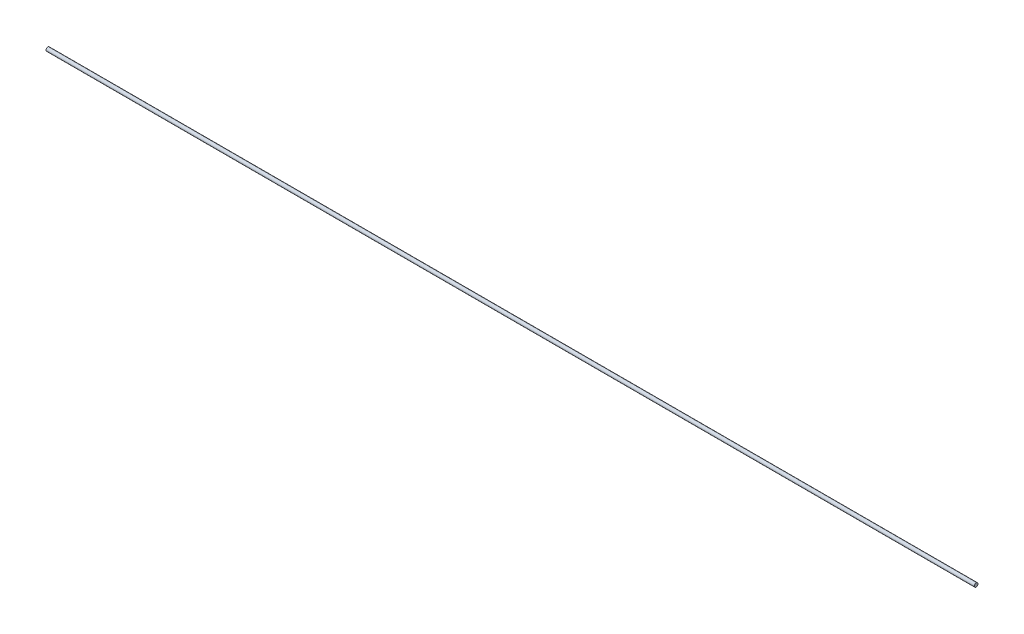
from build123d import *

# Parameters (mm, degrees)
SKETCH1_R           = 3.175
BOSS_EXTRUDE1_DEPTH = 1593.85


with BuildPart() as part:
    # Sketch1 → Boss-Extrude1 (new body)
    with BuildSketch(Plane(origin=(0, 0, 0), x_dir=(0, 0, -1), z_dir=(1, 0, 0))):
        with Locations(Location((0, 0, 0), (0, 0, 180))):
            Circle(SKETCH1_R)
    extrude(amount=BOSS_EXTRUDE1_DEPTH)


solid = part.part
